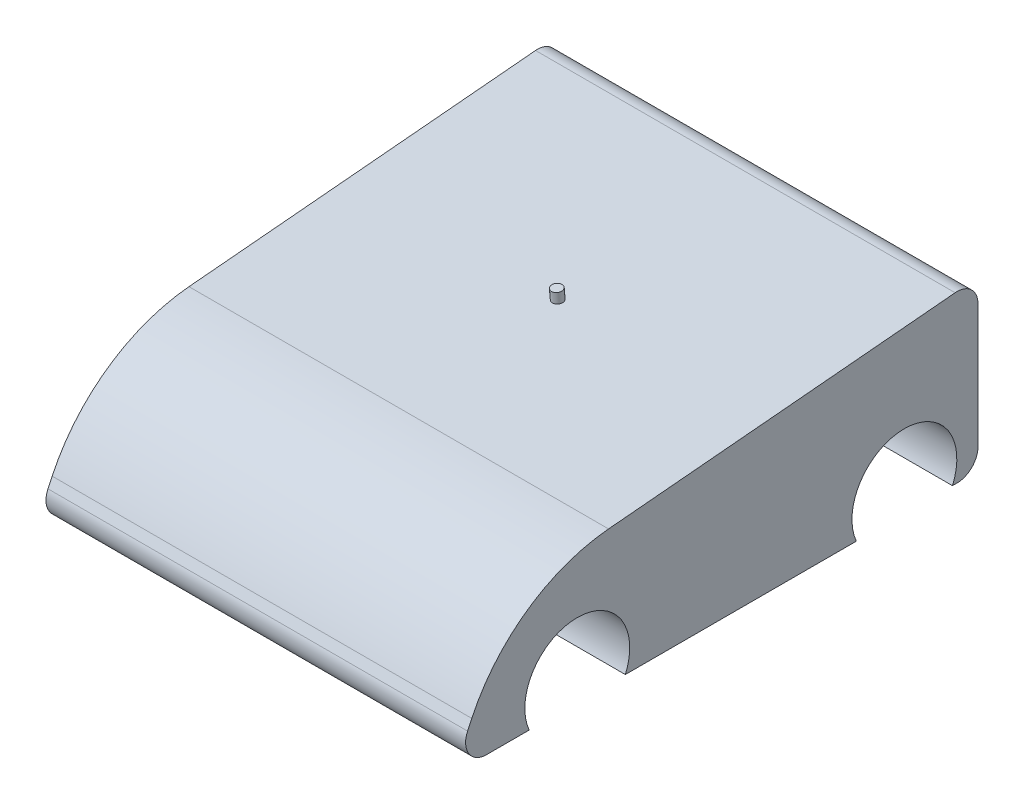
from build123d import *

# Parameters (mm, degrees)
BOSS_EXTRUDE1_DEPTH = 100
SKETCH3_R           = 25
CUT_EXTRUDE1_DEPTH  = 50
SKETCH4_R           = 2.5
BOSS_EXTRUDE2_DEPTH = 5


with BuildPart() as part:
    # Sketch2 → Boss-Extrude1 (new, symmetric)
    with BuildSketch(Plane(origin=(0, 0, 0), x_dir=(0, 0, -1), z_dir=(1, 0, 0))):
        with BuildLine():
            Line((-112.643906845, 14.257821235), (-110.645286598, 18.505070953))
            ThreePointArc((-110.645286598, 18.505070953), (-84.118524888, 49.993435328), (-45.444881226, 64.119137564))
            Line((-45.444881226, 64.119137564), (119.748610721, 79.017143226))
            ThreePointArc((119.748610721, 79.017143226), (127.392850703, 76.439367824), (130.646817248, 69.057563665))
            Line((130.646817248, 69.057563665), (130.646817248, 10))
            ThreePointArc((130.646817248, 10), (127.71788506, 2.928932188), (120.646817248, 0))
            Line((120.646817248, 0), (-103.595649647, 0))
            ThreePointArc((-103.595649647, 0), (-112.038937287, 4.641745263), (-112.643906845, 14.257821235))
        make_face()
    extrude(amount=BOSS_EXTRUDE1_DEPTH, both=True)

    # Sketch3 → Cut-Extrude1 (cut)
    with BuildSketch(Plane(origin=(100, 0, 0), x_dir=(0, 0, -1), z_dir=(1, 0, 0))):
        with Locations((-60.35749377, 10)):
            Circle(SKETCH3_R)
        with Locations((95.561704497, 10)):
            Circle(SKETCH3_R)
    cut_extrude1 = extrude(amount=-CUT_EXTRUDE1_DEPTH, mode=Mode.SUBTRACT)

    # Mirror1: Cut-Extrude1 across plane
    add(cut_extrude1.mirror(Plane(origin=(0, 0, 0), x_dir=(0, 0, 1), z_dir=(1, 0, 0))), mode=Mode.SUBTRACT)

    # Sketch4 → Boss-Extrude2 (add)
    with BuildSketch(Plane(origin=(0, 67.667230134, 6.102581681), x_dir=(1, 0, 0), z_dir=(0, 0.9959579561140941, 0.0898206527088083))):
        with Locations(Location((0, 36.574402855, 0), (0, 0, 90))):
            Circle(SKETCH4_R)
    extrude(amount=BOSS_EXTRUDE2_DEPTH)


solid = part.part
